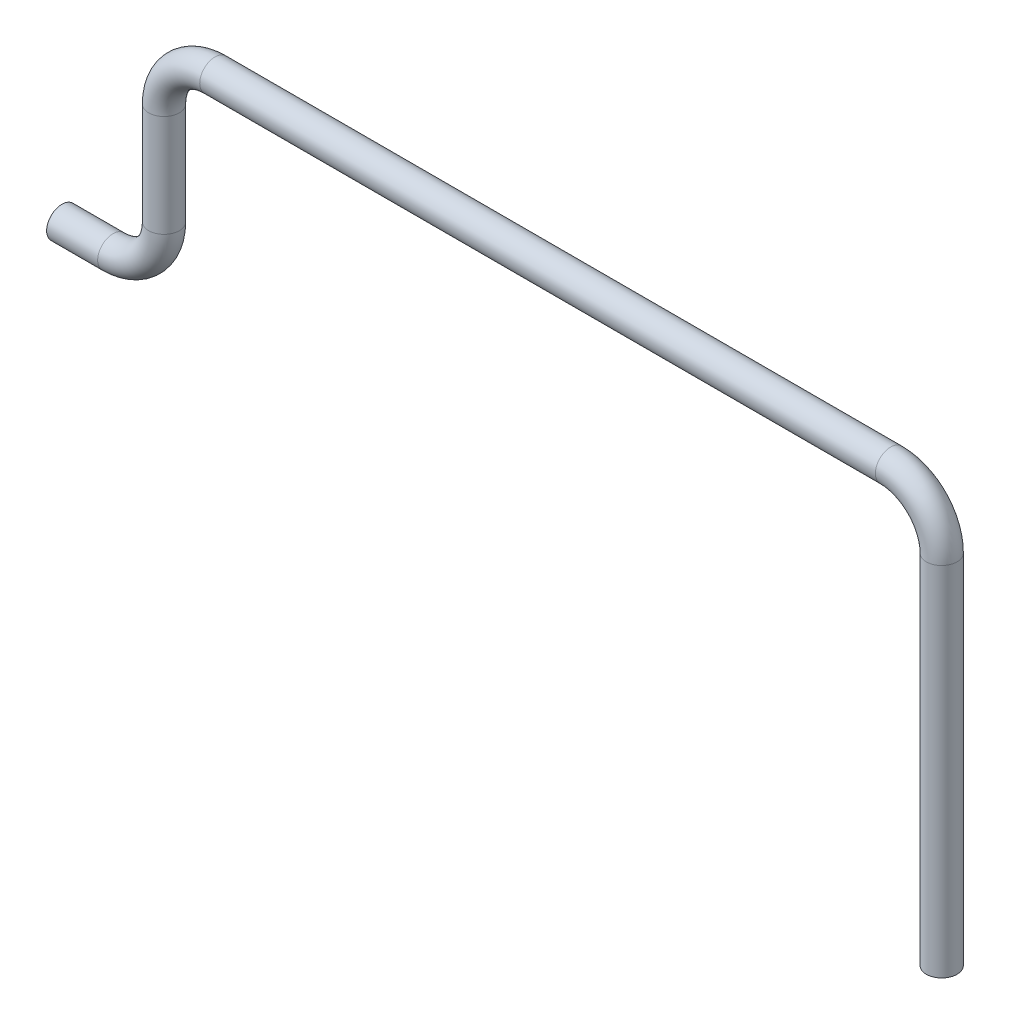
from build123d import *

# Parameters (mm, degrees)
SWEEP1_PROFILE_R = 1.5


with BuildPart() as part:
    # Sweep1: sweep along a path in Sketch1
    with BuildLine(Plane.XY) as sweep1_path:
        Line((0, 0), (5, 0))
        ThreePointArc((5, 0), (8.535533906, 1.464466094), (10, 5))
        Line((10, 5), (10, 15))
        ThreePointArc((10, 15), (11.464466094, 18.535533906), (15, 20))
        Line((15, 20), (81.2, 20))
        ThreePointArc((81.2, 20), (84.735533906, 18.535533906), (86.2, 15))
        Line((86.2, 15), (86.2, -20))
    # Sweep1 profile (on start of the path) → Sweep1 (sweep)
    with BuildSketch(Plane(origin=(0, 0, 0), x_dir=(0, 0, 1), z_dir=(1, 0, 0))):
        Circle(SWEEP1_PROFILE_R)
    sweep(path=sweep1_path.line)


solid = part.part
